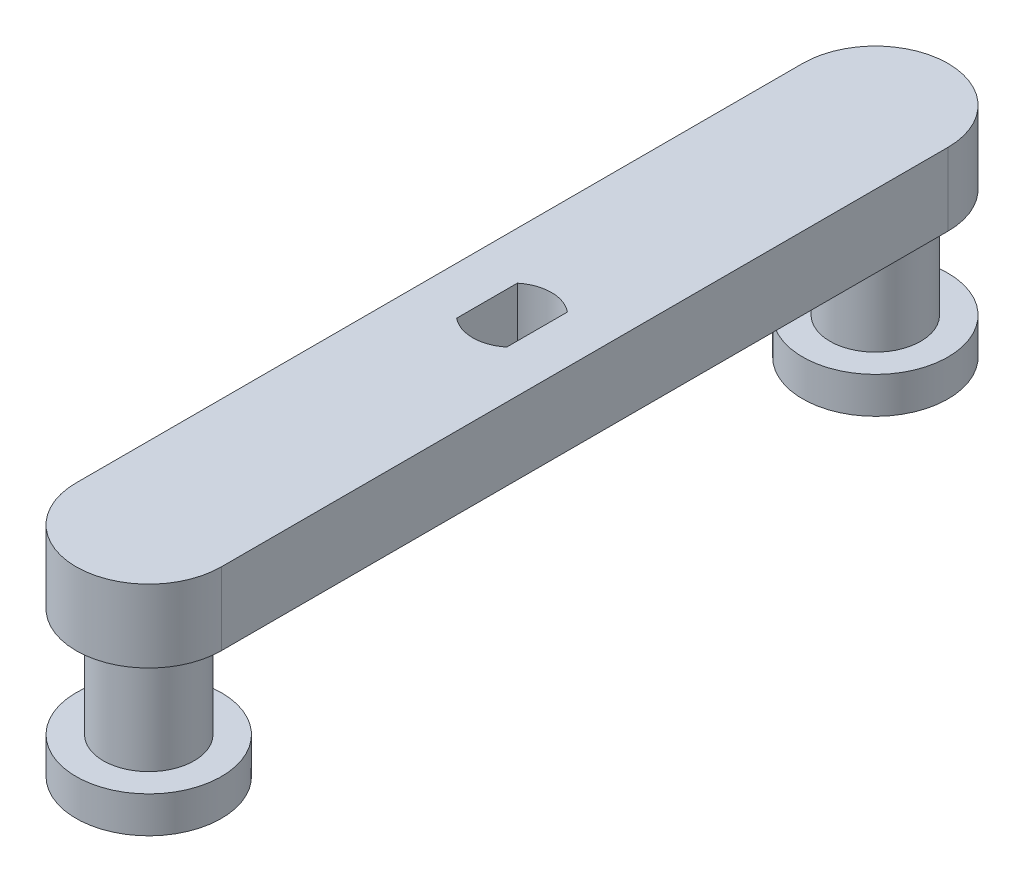
from build123d import *

# Parameters (mm, degrees)
BOSS_EXTRUDE1_DEPTH = 5.08
SKETCH3_R           = 3.175
BOSS_EXTRUDE2_DEPTH = 7.62
BOSS_EXTRUDE3_START = 2.54
SKETCH6_R           = 5.08
BOSS_EXTRUDE3_DEPTH = 2.54
BOSS_EXTRUDE4_START = 2.54
SKETCH8_R           = 5.08
BOSS_EXTRUDE4_DEPTH = 2.54
CUT_EXTRUDE1_REACH  = 36.454


with BuildPart() as part:
    # Sketch2 → Boss-Extrude1 (new body)
    with BuildSketch(Plane(origin=(0, 0, 0), x_dir=(1, 0, 0), z_dir=(0, 1, 0))):
        with BuildLine():
            Line((-5.08, 25.4), (-5.08, -25.4))
            ThreePointArc((-5.08, -25.4), (0, -30.48), (5.08, -25.4))
            Line((5.08, -25.4), (5.08, 25.4))
            ThreePointArc((5.08, 25.4), (0, 30.48), (-5.08, 25.4))
        make_face()
    extrude(amount=BOSS_EXTRUDE1_DEPTH)

    # Sketch3 → Boss-Extrude2 (add)
    with BuildSketch(Plane(origin=(0, 0, 0), x_dir=(-1, 0, 0), z_dir=(0, -1, 0))):
        with Locations(Location((0, -25.4, 0), (0, 0, 270))):
            Circle(SKETCH3_R)
        with Locations(Location((0, 25.4, 0), (0, 0, 270))):
            Circle(SKETCH3_R)
    extrude(amount=BOSS_EXTRUDE2_DEPTH)

    # Sketch6 → Boss-Extrude3 (add)
    with BuildSketch(Plane.XZ.offset(7.62).offset(BOSS_EXTRUDE3_START)):
        with Locations(Location((0, 25.4, 0), (0, 0, 270))):
            Circle(SKETCH6_R)
    extrude(amount=-BOSS_EXTRUDE3_DEPTH)

    # Sketch8 → Boss-Extrude4 (add)
    with BuildSketch(Plane.XZ.offset(7.62).offset(BOSS_EXTRUDE4_START)):
        with Locations(Location((0, -25.4, 0), (0, 0, 270))):
            Circle(SKETCH8_R)
    extrude(amount=-BOSS_EXTRUDE4_DEPTH)

    # Sketch10 → Cut-Extrude1 (cut, up to next)
    with BuildSketch(Plane(origin=(0, 5.08, 0), x_dir=(1, 0, 0), z_dir=(0, 1, 0)), mode=Mode.PRIVATE) as cut_extrude1_sk1:
        with BuildLine():
            Line((-1.75, 2.121320344), (-1.75, -2.121320344))
            ThreePointArc((-1.75, -2.121320344), (0, -2.75), (1.75, -2.121320344))
            Line((1.75, -2.121320344), (1.75, 2.121320344))
            ThreePointArc((1.75, 2.121320344), (0, 2.75), (-1.75, 2.121320344))
        make_face()
    cut_extrude1_tool1 = extrude(cut_extrude1_sk1.sketch, amount=-CUT_EXTRUDE1_REACH, mode=Mode.PRIVATE) & part.part
    add(cut_extrude1_tool1.solids().sort_by_distance((0, 5.08, 0))[0], mode=Mode.SUBTRACT)


solid = part.part
